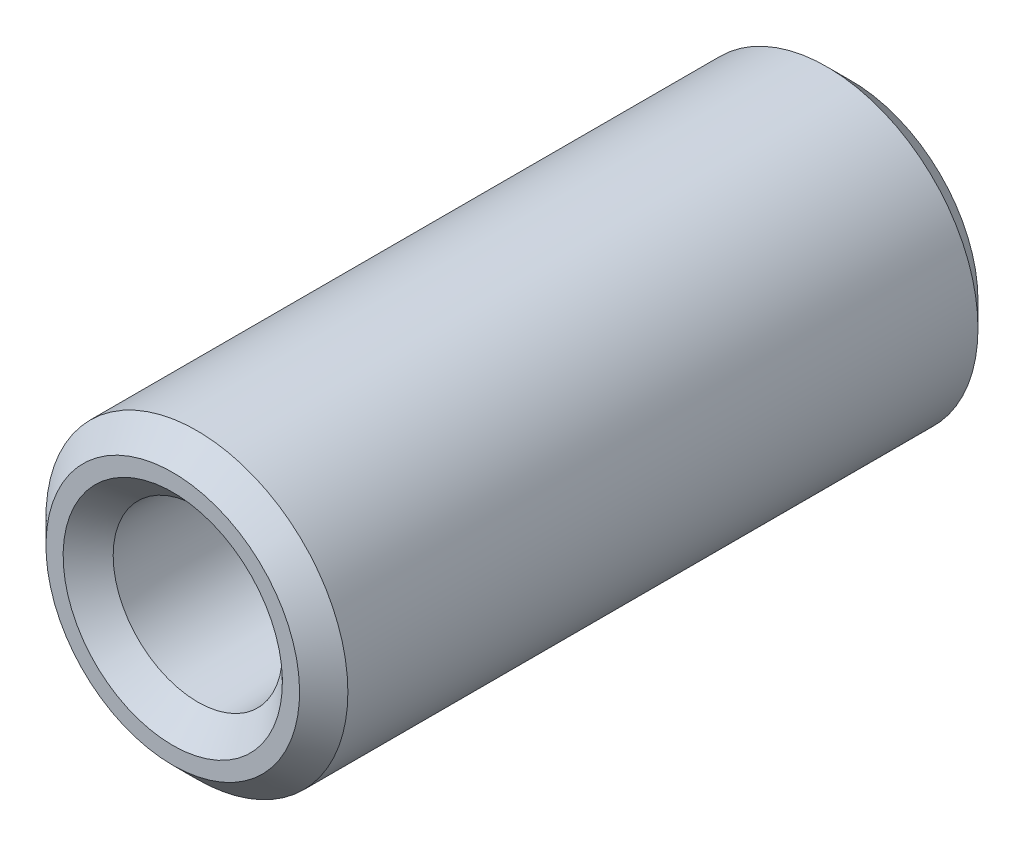
from build123d import *
from OCP.BRepFilletAPI import BRepFilletAPI_MakeChamfer

# Parameters (mm, degrees)
SKETCH1_R           = 3.175
SKETCH1_R_2         = 1.2999974
BOSS_EXTRUDE1_DEPTH = 14.26875
DRAFT2_ANGLE        = -2
CHAMFER1_SIZE       = 0.508
CHAMFER1_SIZE2      = 0.526702505


with BuildPart() as part:
    # Sketch1 → Boss-Extrude1 (new body)
    with BuildSketch(Plane.XY):
        with Locations(Location((0, 6.009690382, 0), (0, 0, 270))):
            Circle(SKETCH1_R)
        with Locations(Location((0, 6.009690382, 0), (0, 0, 270))):
            Circle(SKETCH1_R_2, mode=Mode.SUBTRACT)
    extrude(amount=BOSS_EXTRUDE1_DEPTH)

    # Draft2
    draft2_faces = [part.faces().sort_by_distance(p)[0] for p in [
        (0, 7.309687782, 7.134375),
    ]]
    draft(draft2_faces, Plane(origin=(0, 6.009690382, 0), x_dir=(-1, 0, 0), z_dir=(0, 0, -1)), DRAFT2_ANGLE)

    # Chamfer1: one chamfer whose edges measure the first distance from different faces: ONE call of the kernel's chamfer builder (chamfer() names one face for all edges)
    chamfer1_edges_1 = [part.edges().sort_by_distance(p)[0] for p in [
        (0, 9.184690382, 14.26875),
        (0, 9.184690382, 0),
    ]]
    chamfer1_edges_2 = [part.edges().sort_by_distance(p)[0] for p in [
        (0, 7.807963512, 14.26875),
    ]]
    chamfer1_side_2 = [part.faces().sort_by_distance(p)[0] for p in [
        (0, 9.094887821, 14.26875),
    ]]
    chamfer1 = BRepFilletAPI_MakeChamfer(part.part.solid().wrapped)
    for e in chamfer1_edges_1:
        chamfer1.Add(CHAMFER1_SIZE, e.wrapped)
    for e in chamfer1_edges_2:
        chamfer1.Add(CHAMFER1_SIZE, CHAMFER1_SIZE2, e.wrapped, chamfer1_side_2[0].wrapped)  # the first distance lies on this face
    add(Compound.cast(chamfer1.Shape()), mode=Mode.REPLACE)


solid = part.part
